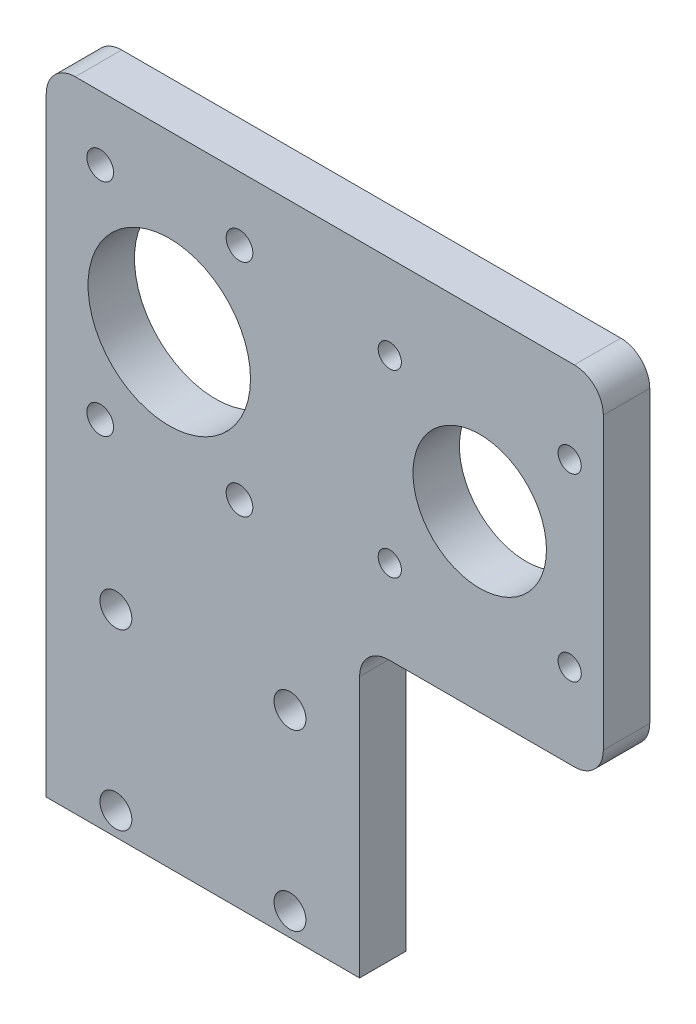
from build123d import *

# Parameters (mm, degrees)
SKETCH_1_R          = 2.75
SKETCH_1_R_2        = 14
SKETCH_1_R_3        = 11.5
SKETCH_1_R_4        = 2
EXTRUDE_1_DEPTH     = 8
FILLET_1_R          = 5
SKETCH_2_R          = 2.3
CUT_EXTRUDE_1_DEPTH = 10


with BuildPart() as part:
    # 草图1 → 凸台-拉伸1 (new body)
    with BuildSketch(Plane.XY):
        Polygon((0, 0), (54, 0), (96, 0), (96, -60), (54, -60), (54, -110), (0, -110), align=None)
        with Locations((12, -106)):
            Circle(SKETCH_1_R, mode=Mode.SUBTRACT)
        with Locations((42, -106)):
            Circle(SKETCH_1_R, mode=Mode.SUBTRACT)
        with Locations((42, -76)):
            Circle(SKETCH_1_R, mode=Mode.SUBTRACT)
        with Locations((12, -76)):
            Circle(SKETCH_1_R, mode=Mode.SUBTRACT)
        with Locations((21.2, -30)):
            Circle(SKETCH_1_R_2, mode=Mode.SUBTRACT)
        with Locations((74.7, -30)):
            Circle(SKETCH_1_R_3, mode=Mode.SUBTRACT)
        with Locations((59.2, -14.5)):
            Circle(SKETCH_1_R_4, mode=Mode.SUBTRACT)
        with Locations((90.2, -14.5)):
            Circle(SKETCH_1_R_4, mode=Mode.SUBTRACT)
        with Locations((90.2, -45.5)):
            Circle(SKETCH_1_R_4, mode=Mode.SUBTRACT)
        with Locations((59.2, -45.5)):
            Circle(SKETCH_1_R_4, mode=Mode.SUBTRACT)
    extrude(amount=EXTRUDE_1_DEPTH)

    # 圆角1
    fillet_1_edges = [part.edges().sort_by_distance(p)[0] for p in [
        (0, 0, 4),
        (96, 0, 4),
        (96, -60, 4),
        (54, -60, 4),
    ]]
    fillet(fillet_1_edges, radius=FILLET_1_R)

    # 草图2 → 切除-拉伸1 (cut)
    with BuildSketch(Plane.XY.offset(8)):
        with Locations((9.3, -11)):
            Circle(SKETCH_2_R)
        with Locations((33.3, -11)):
            Circle(SKETCH_2_R)
        with Locations((33.3, -49)):
            Circle(SKETCH_2_R)
        with Locations((9.3, -49)):
            Circle(SKETCH_2_R)
    extrude(amount=-CUT_EXTRUDE_1_DEPTH, mode=Mode.SUBTRACT)


solid = part.part
